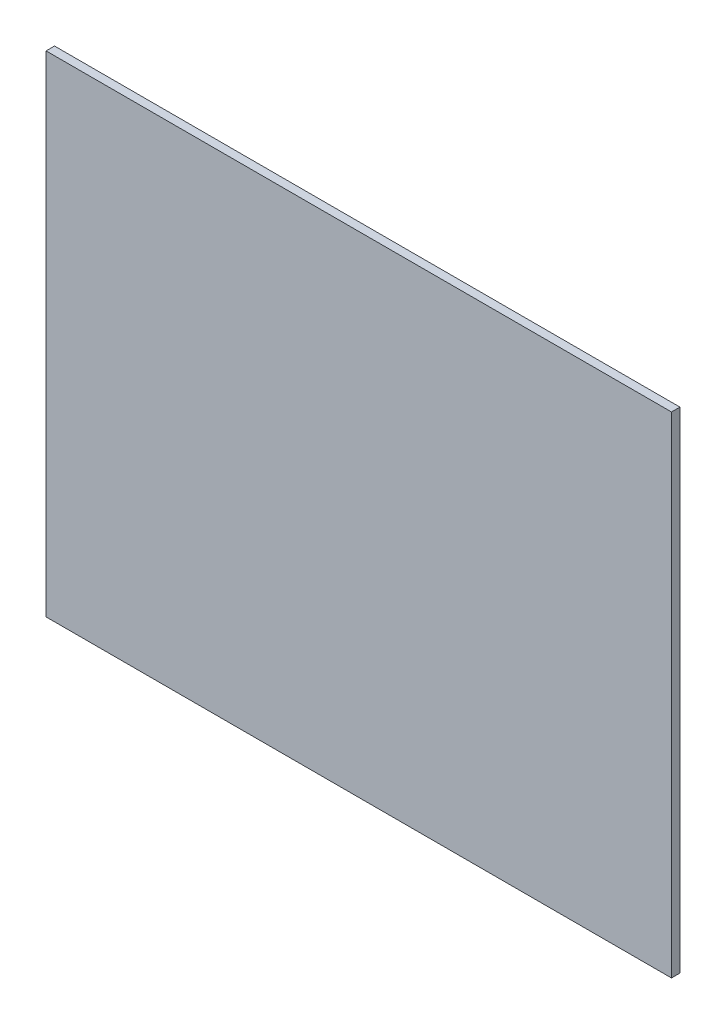
from build123d import *

# Parameters (mm, degrees)
SKETCH1_W           = 2.22
SKETCH1_H           = 1.74
BOSS_EXTRUDE1_DEPTH = 0.03


with BuildPart() as part:
    # Sketch1 → Boss-Extrude1 (new body)
    with BuildSketch(Plane.XY):
        with Locations((-0.61, 0)):
            Rectangle(SKETCH1_W, SKETCH1_H)
    extrude(amount=-BOSS_EXTRUDE1_DEPTH)


solid = part.part
